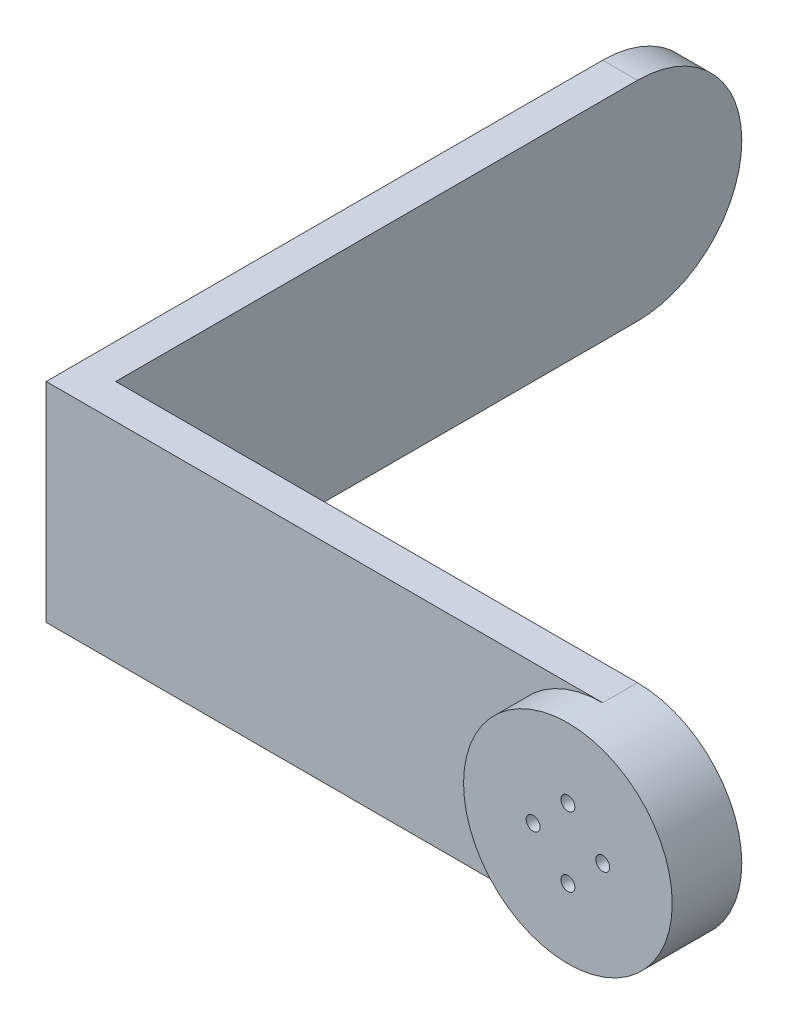
from build123d import *

# Parameters (mm, degrees)
SKETCH1_R           = 15
FACE_2_DEPTH        = 5
L_START             = -5
L_LINK_DEPTH        = 5
SKETCH3_R           = 1
FIXING_SCREWS_DEPTH = 83.006097334


with BuildPart() as part:
    # Sketch1 → face 2 (new body)
    with BuildSketch(Plane.XY):
        Circle(SKETCH1_R)
    extrude(amount=FACE_2_DEPTH)

    # Sketch2 → L link (add)
    with BuildSketch(Plane.XY.offset(L_START)):
        with BuildLine():
            ThreePointArc((0, -15), (-15, 0), (0, 15))
            Line((0, 15), (-80, 15))
            Line((-80, 15), (-80, -15))
            Line((-80, -15), (0, -15))
        make_face()
        with BuildLine():
            ThreePointArc((15, 0), (10.606601718, 10.606601718), (0, 15))
            Line((0, 15), (0, -15))
            ThreePointArc((0, -15), (10.606601718, -10.606601718), (15, 0))
        make_face()
        with BuildLine():
            Line((0, -15), (0, 15))
            ThreePointArc((0, 15), (-15, 0), (0, -15))
        make_face()
    l_link = extrude(amount=L_LINK_DEPTH)

    # Sketch3 → fixing screws (cut, through all)
    with BuildSketch(Plane.XY.offset(5)):
        with Locations((0, 5)):
            Circle(SKETCH3_R)
        with Locations((5, 0)):
            Circle(SKETCH3_R)
        with Locations((0, -5)):
            Circle(SKETCH3_R)
        with Locations((-5, 0)):
            Circle(SKETCH3_R)
    extrude(amount=-FIXING_SCREWS_DEPTH, mode=Mode.SUBTRACT)

    # Mirror2: L link across plane
    add(l_link.mirror(Plane(origin=(-40, 0, -40), x_dir=(-0.7071067811865478, 0, 0.7071067811865472), z_dir=(0.7071067811865475, 0, 0.7071067811865477))))


solid = part.part
